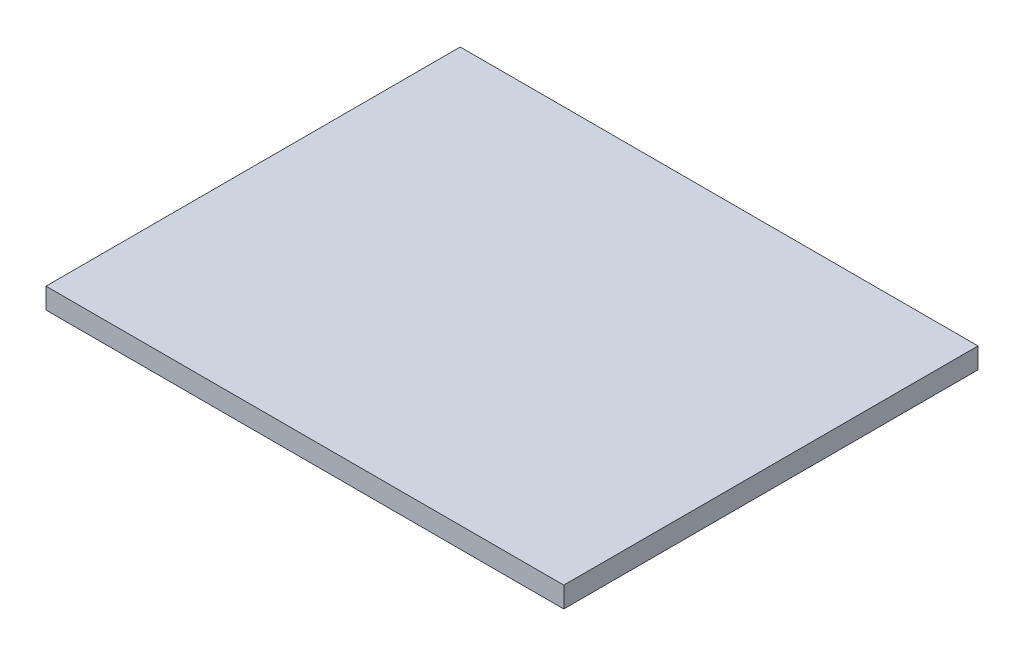
from build123d import *

# Parameters (mm, degrees)
SKETCH1_W           = 500
SKETCH1_H           = 400
BOSS_EXTRUDE1_DEPTH = 20


with BuildPart() as part:
    # Sketch1 → Boss-Extrude1 (new body)
    with BuildSketch(Plane(origin=(0, 0, 0), x_dir=(1, 0, 0), z_dir=(0, 1, 0))):
        Rectangle(SKETCH1_W, SKETCH1_H)
    extrude(amount=BOSS_EXTRUDE1_DEPTH)


solid = part.part
